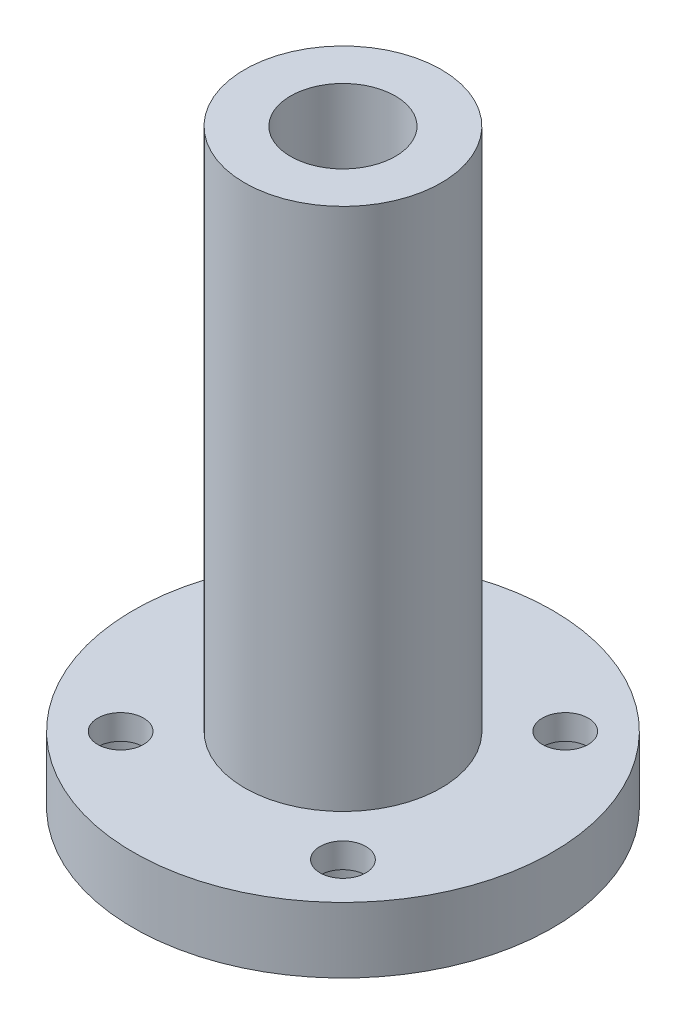
from build123d import *

# Parameters (mm, degrees)
SKETCH_1_W                   = 16
SKETCH_1_H                   = 5
SKETCH_2_R                   = 7.5
EXTRUDE_1_DEPTH              = 40
HOLE_WIZARD_M3_1_D           = 3.5
HOLE_WIZARD_M3_1_DEPTH       = 45
HOLE_WIZARD_M3_1_CBORE_D     = 6
HOLE_WIZARD_M3_1_CBORE_DEPTH = 3.1
HOLE_WIZARD_8_0_8_1_D        = 8


with BuildPart() as part:
    # 草图1 → 旋转1 (revolve)
    with BuildSketch(Plane.XY, mode=Mode.PRIVATE) as revolve_1_sk:
        with Locations((8, 2.5)):
            Rectangle(SKETCH_1_W, SKETCH_1_H)
    revolve(revolve_1_sk.sketch.rotate(Axis((0, 5, 0), (0, -1, 0)), 270), axis=Axis((0, 5, 0), (0, -1, 0)))

    # 草图2 → 凸台-拉伸1 (add)
    with BuildSketch(Plane(origin=(0, 5, 0), x_dir=(-1, 0, 0), z_dir=(0, 1, 0))):
        with Locations(Location((0, 0, 0), (0, 0, 90))):
            Circle(SKETCH_2_R)
    extrude(amount=EXTRUDE_1_DEPTH)

    # M3 六角头机械螺钉的柱形沉头孔1
    with Locations(Plane(origin=(0, 0, 0), x_dir=(-1, 0, 0), z_dir=(0, -1, 0))):
        with Locations((8.485281374, 8.485281374), (-8.485281374, 8.485281374), (-8.485281374, -8.485281374), (8.485281374, -8.485281374)):
            CounterBoreHole(HOLE_WIZARD_M3_1_D / 2, HOLE_WIZARD_M3_1_CBORE_D / 2, HOLE_WIZARD_M3_1_CBORE_DEPTH, depth=HOLE_WIZARD_M3_1_DEPTH)

    # Ø8.0 (8) 直径孔1 (through all)
    with Locations(Plane(origin=(0, 0, 0), x_dir=(-1, 0, 0), z_dir=(0, -1, 0))):
        with Locations((0, 0)):
            Hole(HOLE_WIZARD_8_0_8_1_D / 2)


solid = part.part
